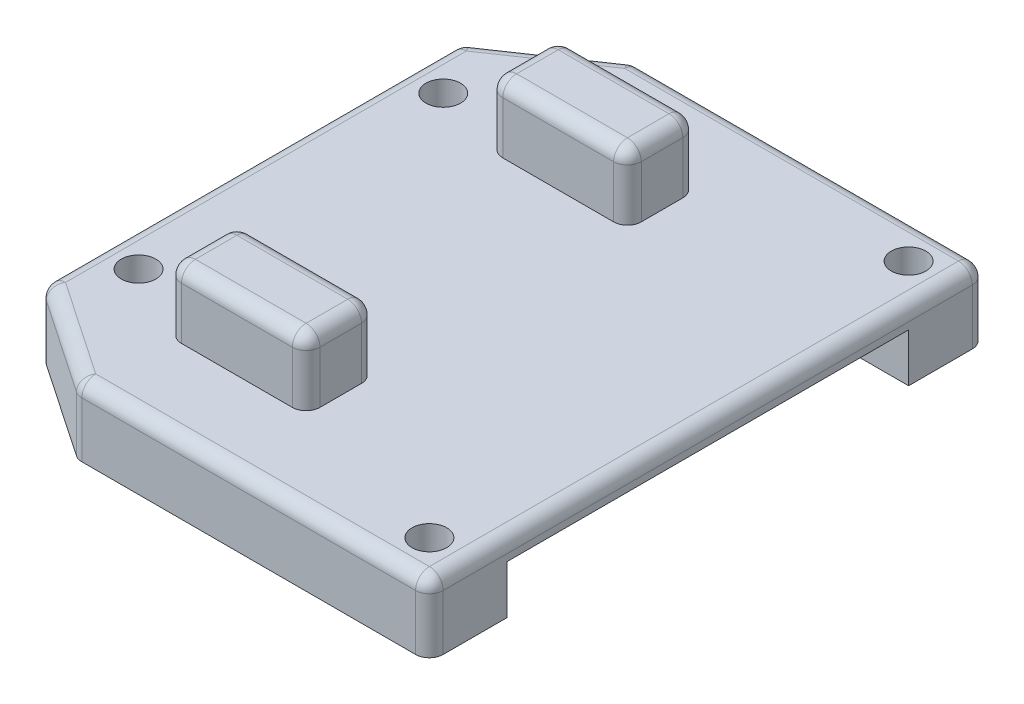
from build123d import *

# Parameters (mm, degrees)
SKETCH1_W           = 32.9
SKETCH1_H           = 40.2
BOSS_EXTRUDE1_DEPTH = 5
SKETCH2_W           = 29
SKETCH2_H           = 3.5
CUT_EXTRUDE1_DEPTH  = 27.3
SKETCH3_R           = 1.25
CUT_EXTRUDE2_DEPTH  = 27.450189035
SKETCH4_W           = 10
SKETCH4_H           = 5
BOSS_EXTRUDE2_DEPTH = 4.7625
CHAMFER1_SIZE       = 7.5
CHAMFER1_SIZE2      = 5.1
CHAMFER2_SIZE       = 5.1
CHAMFER2_SIZE2      = 7.5
FILLET1_R           = 1


with BuildPart() as part:
    # Sketch1 → Boss-Extrude1 (new body)
    with BuildSketch(Plane(origin=(0, 0, 0), x_dir=(1, 0, 0), z_dir=(0, 1, 0))):
        Rectangle(SKETCH1_W, SKETCH1_H)
    extrude(amount=BOSS_EXTRUDE1_DEPTH)

    # Sketch2 → Cut-Extrude1 (cut)
    with BuildSketch(Plane(origin=(16.45, 0, 0), x_dir=(0, 0, -1), z_dir=(1, 0, 0))):
        with Locations((0, 1.75)):
            Rectangle(SKETCH2_W, SKETCH2_H)
    extrude(amount=-CUT_EXTRUDE1_DEPTH, mode=Mode.SUBTRACT)

    # Sketch3 → Cut-Extrude2 (cut, through all)
    with BuildSketch(Plane(origin=(0, 5, 0), x_dir=(1, 0, 0), z_dir=(0, 1, 0))):
        with Locations(Location((13.65, 17.3, 0), (0, 0, 270))):
            Circle(SKETCH3_R)
        with Locations(Location((-13.65, 11, 0), (0, 0, 270))):
            Circle(SKETCH3_R)
    cut_extrude2 = extrude(amount=-CUT_EXTRUDE2_DEPTH, mode=Mode.SUBTRACT)

    # Sketch4 → Boss-Extrude2 (add)
    with BuildSketch(Plane(origin=(0, 5, 0), x_dir=(-1, 0, 0), z_dir=(0, 1, 0))):
        with Locations((3.45, -11.6)):
            Rectangle(SKETCH4_W, SKETCH4_H)
    boss_extrude2 = extrude(amount=BOSS_EXTRUDE2_DEPTH)

    # Mirror1: Cut-Extrude2, Boss-Extrude2 across plane
    add(cut_extrude2.mirror(Plane.XY), mode=Mode.SUBTRACT)
    add(boss_extrude2.mirror(Plane.XY))

    # Chamfer1
    chamfer1_edges = [part.edges().sort_by_distance(p)[0] for p in [
        (-16.45, 2.5, -20.1),
    ]]
    chamfer1_side = [part.faces().sort_by_distance(p)[0] for p in [
        (0, 2.5, -20.1),
    ]]
    chamfer(chamfer1_edges, length=CHAMFER1_SIZE, length2=CHAMFER1_SIZE2, reference=chamfer1_side[0])

    # Chamfer2
    chamfer2_edges = [part.edges().sort_by_distance(p)[0] for p in [
        (-16.45, 2.5, 20.1),
    ]]
    chamfer2_side = [part.faces().sort_by_distance(p)[0] for p in [
        (-16.45, 2.5, 2.55),
    ]]
    chamfer(chamfer2_edges, length=CHAMFER2_SIZE, length2=CHAMFER2_SIZE2, reference=chamfer2_side[0])

    # Fillet1
    fillet1_edges = [part.edges().sort_by_distance(p)[0] for p in [
        (1.55, 7.38125, -9.1),
        (1.55, 7.38125, -14.1),
        (16.45, 5, 0),
        (-8.45, 7.38125, -14.1),
        (-8.45, 7.38125, -9.1),
        (1.55, 9.7625, -11.6),
        (-3.45, 9.7625, -14.1),
        (-8.45, 9.7625, -11.6),
        (-3.45, 9.7625, -9.1),
        (1.55, 9.7625, 11.6),
        (1.55, 7.38125, 14.1),
        (-3.45, 9.7625, 9.1),
        (1.55, 7.38125, 9.1),
        (-8.45, 9.7625, 11.6),
        (-8.45, 7.38125, 9.1),
        (-3.45, 9.7625, 14.1),
        (-8.45, 7.38125, 14.1),
        (3.75, 5, -20.1),
        (-16.45, 5, 0),
        (-16.45, 2.5, -15),
        (-8.95, 2.5, -20.1),
        (-12.7, 5, -17.55),
        (16.45, 2.5, 20.1),
        (3.75, 5, 20.1),
        (-8.95, 2.5, 20.1),
        (16.45, 2.5, -20.1),
        (-16.45, 2.5, 15),
        (-12.7, 5, 17.55),
    ]]
    fillet(fillet1_edges, radius=FILLET1_R)


solid = part.part
